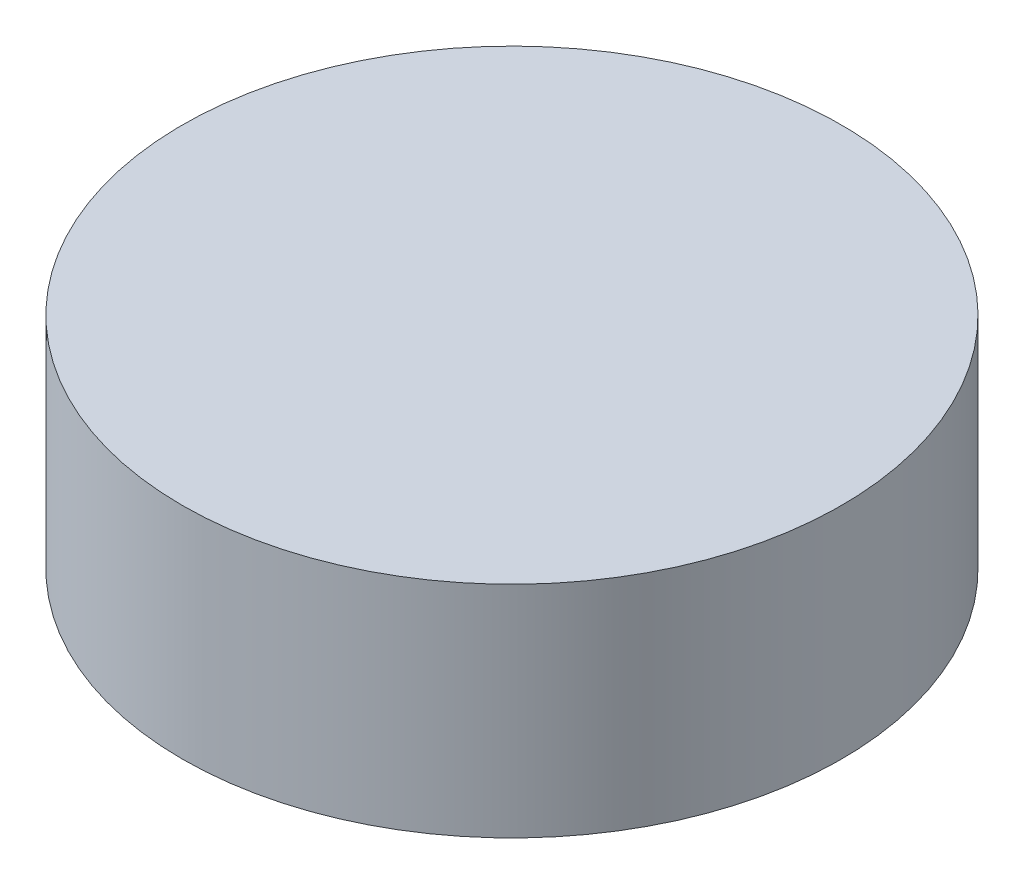
from build123d import *

# Parameters (mm, degrees)
SKETCH1_R           = 150
BOSS_EXTRUDE1_DEPTH = 100


with BuildPart() as part:
    # Sketch1 → Boss-Extrude1 (new body)
    with BuildSketch(Plane(origin=(0, 0, 0), x_dir=(1, 0, 0), z_dir=(0, 1, 0))):
        with Locations(Location((0, 0, 0), (0, 0, 270))):
            Circle(SKETCH1_R)
    extrude(amount=BOSS_EXTRUDE1_DEPTH)


solid = part.part
